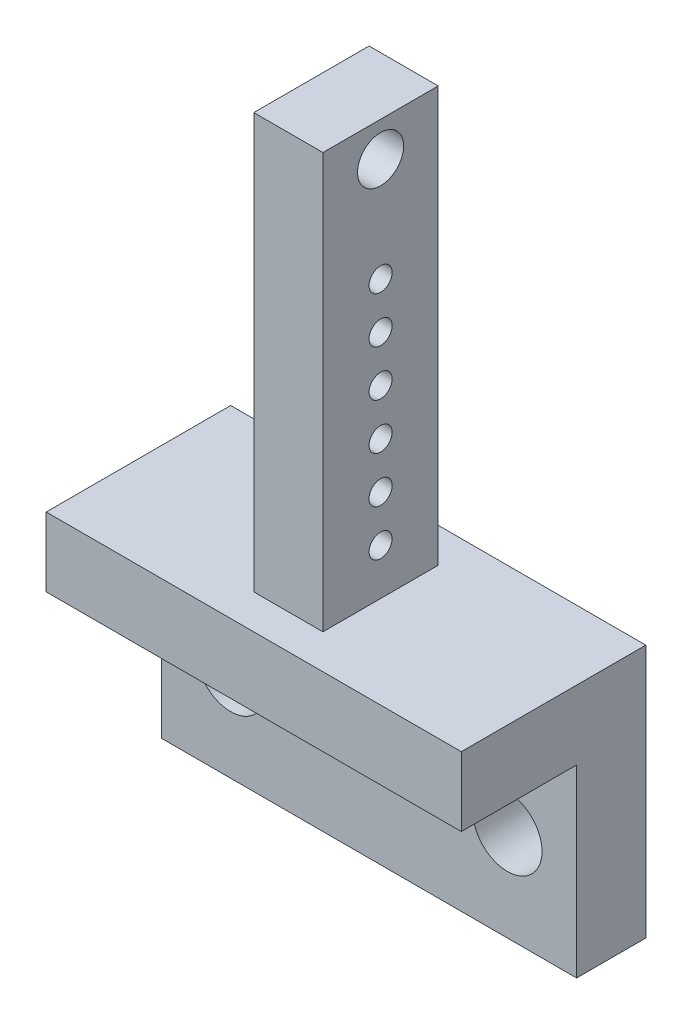
from build123d import *

# Parameters (mm, degrees)
ESQUISSE1_W             = 18
ESQUISSE1_H             = 11
ESQUISSE1_R             = 1.5
BOSS_EXTRU_1_DEPTH      = 3
ESQUISSE2_W             = 18
ESQUISSE2_H             = 3
BOSS_EXTRU_2_DEPTH      = 5
ESQUISSE3_W             = 3
ESQUISSE3_H             = 5
BOSS_EXTRU_3_DEPTH      = 18
ESQUISSE4_R             = 0.5
ESQUISSE4_R_2           = 1
ENL_V_MAT_EXTRU_1_DEPTH = 18


with BuildPart() as part:
    # Esquisse1 → Boss.-Extru.1 (new body)
    with BuildSketch(Plane.XY):
        with Locations((-8.232718894, -0.823732719)):
            Rectangle(ESQUISSE1_W, ESQUISSE1_H)
        with Locations((-14.232718894, -2.323732719)):
            Circle(ESQUISSE1_R, mode=Mode.SUBTRACT)
        with Locations((-2.232718894, -2.323732719)):
            Circle(ESQUISSE1_R, mode=Mode.SUBTRACT)
    extrude(amount=BOSS_EXTRU_1_DEPTH)

    # Esquisse2 → Boss.-Extru.2 (add)
    with BuildSketch(Plane.XY.offset(3)):
        with Locations((-8.232718894, 3.176267281)):
            Rectangle(ESQUISSE2_W, ESQUISSE2_H)
    extrude(amount=BOSS_EXTRU_2_DEPTH)

    # Esquisse3 → Boss.-Extru.3 (add)
    with BuildSketch(Plane(origin=(0, 4.676267281, 0), x_dir=(1, 0, 0), z_dir=(0, 1, 0))):
        with Locations((-8.232718894, -4)):
            Rectangle(ESQUISSE3_W, ESQUISSE3_H)
    extrude(amount=BOSS_EXTRU_3_DEPTH)

    # Esquisse4 → Enlèv. mat.-Extru.1 (cut)
    with BuildSketch(Plane(origin=(-6.732718894, 0, 0), x_dir=(0, 0, -1), z_dir=(1, 0, 0))):
        with BuildLine():
            ThreePointArc((-4, 7.176267281), (-4.5, 6.676267281), (-4, 6.176267281))
            Line((-4, 6.176267281), (-4, 7.176267281))
        make_face()
        with BuildLine():
            Line((-4, 7.176267281), (-4, 6.176267281))
            ThreePointArc((-4, 6.176267281), (-3.646446609, 6.322713891), (-3.5, 6.676267281))
            ThreePointArc((-3.5, 6.676267281), (-3.646446609, 7.029820672), (-4, 7.176267281))
        make_face()
        with Locations((-4, 8.676267281)):
            Circle(ESQUISSE4_R)
        with Locations((-4, 10.676267281)):
            Circle(ESQUISSE4_R)
        with Locations((-4, 12.676267281)):
            Circle(ESQUISSE4_R)
        with Locations((-4, 14.676267281)):
            Circle(ESQUISSE4_R)
        with Locations((-4, 16.676267281)):
            Circle(ESQUISSE4_R)
        with Locations((-4, 21.176267281)):
            Circle(ESQUISSE4_R_2)
    extrude(amount=-ENL_V_MAT_EXTRU_1_DEPTH, mode=Mode.SUBTRACT)


solid = part.part
